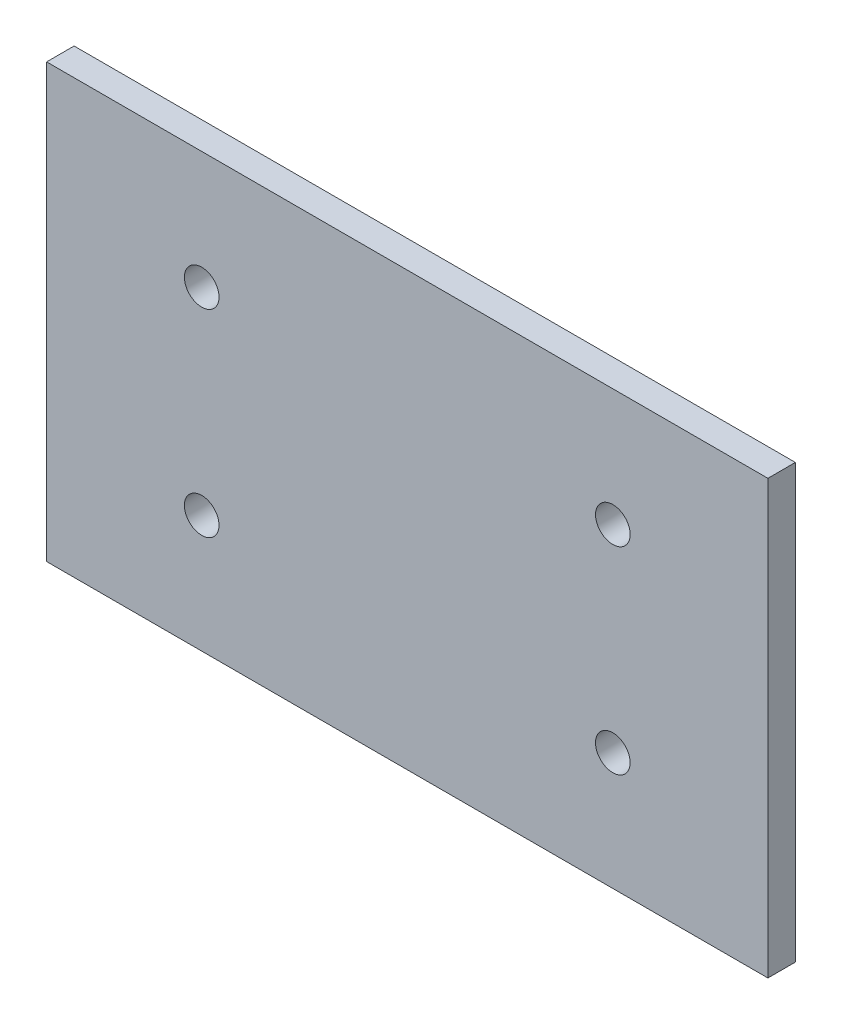
from build123d import *

# Parameters (mm, degrees)
SKETCH1_W           = 250
SKETCH1_H           = 150
SKETCH1_R           = 6
BOSS_EXTRUDE1_DEPTH = 9.525


with BuildPart() as part:
    # Sketch1 → Boss-Extrude1 (new body)
    with BuildSketch(Plane.XY):
        with Locations((125, -75)):
            Rectangle(SKETCH1_W, SKETCH1_H)
        with Locations(Location((53.75, -40.75, 0), (0, 0, 180))):
            Circle(SKETCH1_R, mode=Mode.SUBTRACT)
        with Locations(Location((196.25, -40.75, 0), (0, 0, 180))):
            Circle(SKETCH1_R, mode=Mode.SUBTRACT)
        with Locations(Location((196.25, -109.25, 0), (0, 0, 180))):
            Circle(SKETCH1_R, mode=Mode.SUBTRACT)
        with Locations(Location((53.75, -109.25, 0), (0, 0, 180))):
            Circle(SKETCH1_R, mode=Mode.SUBTRACT)
    extrude(amount=BOSS_EXTRUDE1_DEPTH)


solid = part.part
